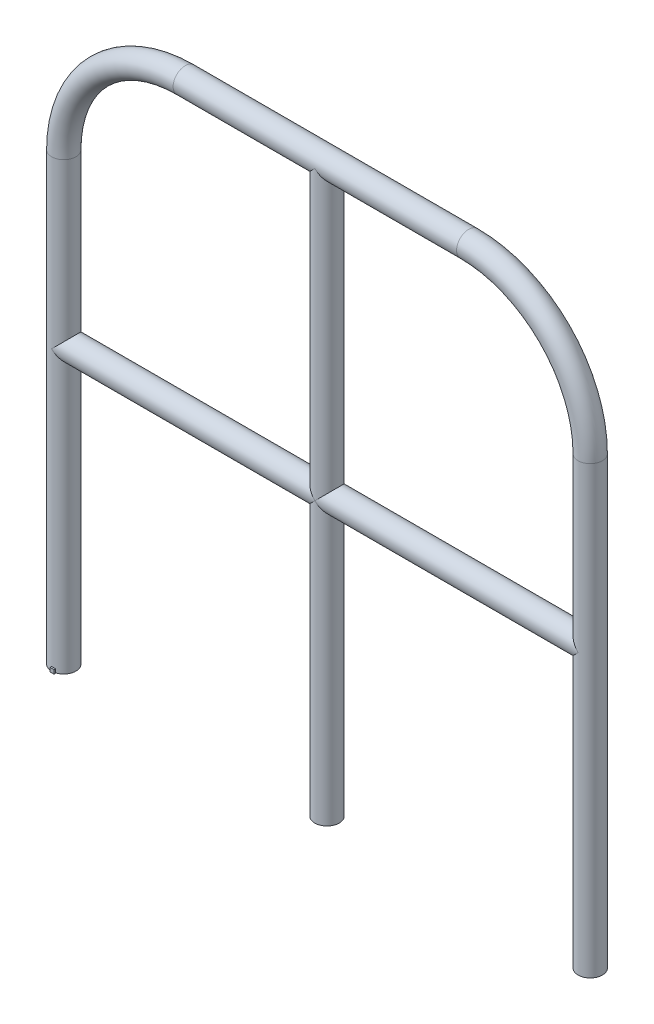
from build123d import *

# Parameters (mm, degrees)
SKETCH_2_R      = 30
SKETCH_4_R      = 30
EXTRUDE_1_DEPTH = 1400
SKETCH_5_R      = 30
EXTRUDE_2_DEPTH = 1300
SKETCH_6_W      = 9.757055714
SKETCH_6_H      = 3.616600388
EXTRUDE_3_DEPTH = 10


with BuildPart() as part:
    # 扫描1: sweep along a path in 草图1
    with BuildLine(Plane.XY) as sweep_1_path:
        Line((0, 0), (0, 1100))
        ThreePointArc((0, 1100), (87.867965644, 1312.132034356), (300, 1400))
        Line((300, 1400), (1000, 1400))
        ThreePointArc((1000, 1400), (1212.132034356, 1312.132034356), (1300, 1100))
        Line((1300, 1100), (1300, 0))
    # 草图2 → 扫描1 (sweep)
    with BuildSketch(Plane(origin=(0, 0, 0), x_dir=(1, 0, 0), z_dir=(0, 1, 0))):
        Circle(SKETCH_2_R)
    sweep(path=sweep_1_path.line)

    # 草图4 → 凸台-拉伸1 (add)
    with BuildSketch(Plane(origin=(0, 0, 0), x_dir=(1, 0, 0), z_dir=(0, 1, 0))):
        with Locations(Location((650, 0, 0), (0, 0, 270))):
            Circle(SKETCH_4_R)
    extrude(amount=EXTRUDE_1_DEPTH)

    # 草图5 → 凸台-拉伸2 (add)
    with BuildSketch(Plane(origin=(0, 0, 0), x_dir=(0, 0, -1), z_dir=(1, 0, 0))):
        with Locations(Location((0, 689.391024167, 0), (0, 0, 180))):
            Circle(SKETCH_5_R)
    extrude(amount=EXTRUDE_2_DEPTH)


with BuildPart() as body_2:
    # 草图6 → 凸台-拉伸3 (new body)
    with BuildSketch(Plane.XZ):
        with Locations((4.878527857, 31.808300194)):
            Rectangle(SKETCH_6_W, SKETCH_6_H)
    extrude(amount=-EXTRUDE_3_DEPTH)


solid = Compound([part.part, body_2.part])
